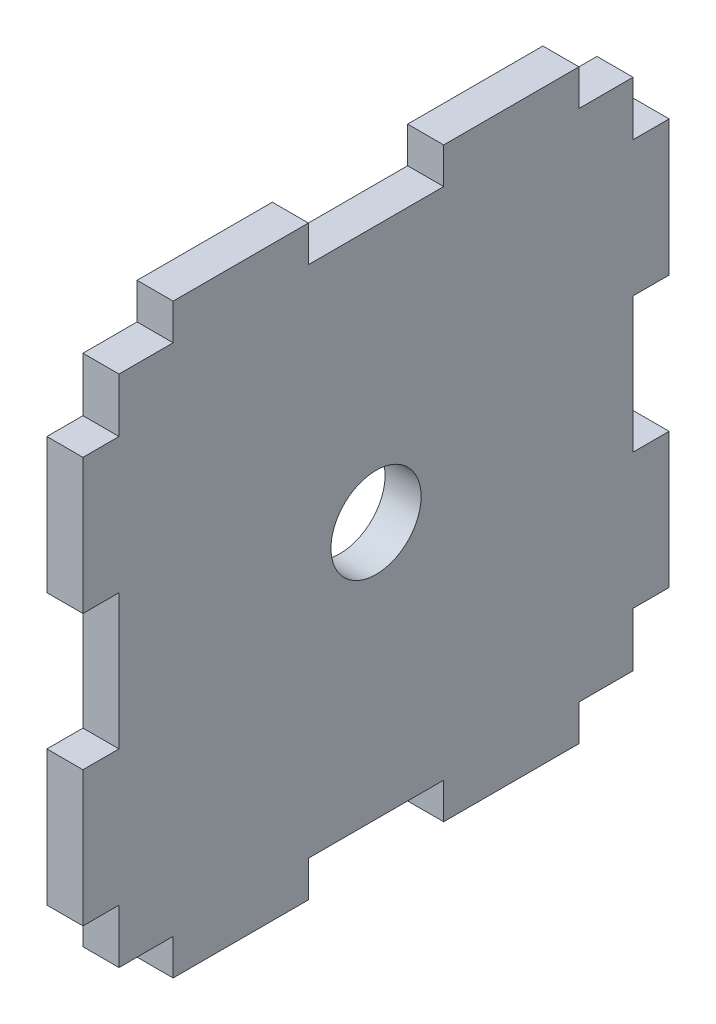
from build123d import *

# Parameters (mm, degrees)
SKETCH1_W           = 65
SKETCH1_H           = 65
BOSS_EXTRUDE1_DEPTH = 4
SKETCH2_R           = 5
CUT_EXTRUDE1_DEPTH  = 4
SKETCH3_W           = 10
SKETCH3_H           = 4
SKETCH3_W_2         = 15
CUT_EXTRUDE2_DEPTH  = 4
SKETCH5_W           = 4
SKETCH5_H           = 6
SKETCH5_H_2         = 15
CUT_EXTRUDE3_DEPTH  = 4


with BuildPart() as part:
    # Sketch1 → Boss-Extrude1 (new body)
    with BuildSketch(Plane(origin=(0, 0, 0), x_dir=(0, 0, -1), z_dir=(1, 0, 0))):
        with Locations((32.5, 32.5)):
            Rectangle(SKETCH1_W, SKETCH1_H)
    extrude(amount=BOSS_EXTRUDE1_DEPTH)

    # Sketch2 → Cut-Extrude1 (cut)
    with BuildSketch(Plane(origin=(4, 0, 0), x_dir=(0, 0, -1), z_dir=(1, 0, 0))):
        with Locations((32.5, 32.5)):
            Circle(SKETCH2_R)
    extrude(amount=-CUT_EXTRUDE1_DEPTH, mode=Mode.SUBTRACT)

    # Sketch3 → Cut-Extrude2 (cut)
    with BuildSketch(Plane(origin=(4, 0, 0), x_dir=(0, 0, -1), z_dir=(1, 0, 0))):
        with Locations((5, 63)):
            Rectangle(SKETCH3_W, SKETCH3_H)
        with Locations((32.5, 63)):
            Rectangle(SKETCH3_W_2, SKETCH3_H)
        with Locations((60, 63)):
            Rectangle(SKETCH3_W, SKETCH3_H)
        with Locations((60, 2)):
            Rectangle(SKETCH3_W, SKETCH3_H)
        with Locations((32.5, 2)):
            Rectangle(SKETCH3_W_2, SKETCH3_H)
        with Locations((5, 2)):
            Rectangle(SKETCH3_W, SKETCH3_H)
    extrude(amount=-CUT_EXTRUDE2_DEPTH, mode=Mode.SUBTRACT)

    # Sketch5 → Cut-Extrude3 (cut)
    with BuildSketch(Plane(origin=(4, 0, 0), x_dir=(0, 0, -1), z_dir=(1, 0, 0))):
        with Locations((2, 58)):
            Rectangle(SKETCH5_W, SKETCH5_H)
        with Locations((2, 32.5)):
            Rectangle(SKETCH5_W, SKETCH5_H_2)
        with Locations((2, 7)):
            Rectangle(SKETCH5_W, SKETCH5_H)
        with Locations((63, 7)):
            Rectangle(SKETCH5_W, SKETCH5_H)
        with Locations((63, 32.5)):
            Rectangle(SKETCH5_W, SKETCH5_H_2)
        with Locations((63, 58)):
            Rectangle(SKETCH5_W, SKETCH5_H)
    extrude(amount=-CUT_EXTRUDE3_DEPTH, mode=Mode.SUBTRACT)


solid = part.part
